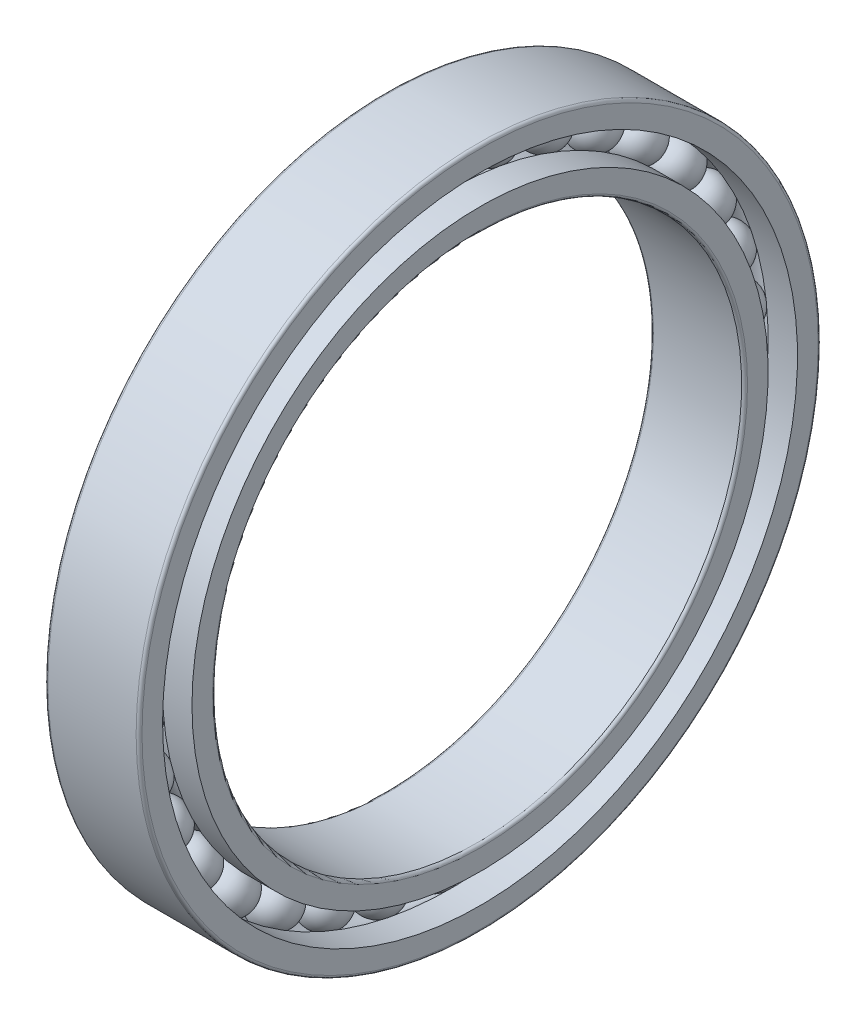
from build123d import *

# Parameters (mm, degrees)
CIRPATTERN1_COUNT = 34


with BuildPart() as part:
    # Sketch2 → Revolve1 (revolve)
    with BuildSketch(Plane.XY, mode=Mode.PRIVATE) as revolve1_sk:
        with BuildLine():
            Line((-3.75, 29), (3.75, 29))
            ThreePointArc((3.75, 29), (3.926776695, 28.926776695), (4, 28.75))
            Line((4, 28.75), (4, 27))
            Line((4, 27), (1.496662955, 27))
            ThreePointArc((1.496662955, 27), (0, 27.7), (-1.496662955, 27))
            Line((-1.496662955, 27), (-4, 27))
            Line((-4, 27), (-4, 28.75))
            ThreePointArc((-4, 28.75), (-3.926776695, 28.926776695), (-3.75, 29))
        make_face()
        with BuildLine():
            Line((4, 24.5), (4, 22.75))
            ThreePointArc((4, 22.75), (3.926776695, 22.573223305), (3.75, 22.5))
            Line((3.75, 22.5), (-3.75, 22.5))
            ThreePointArc((-3.75, 22.5), (-3.926776695, 22.573223305), (-4, 22.75))
            Line((-4, 22.75), (-4, 24.5))
            Line((-4, 24.5), (-1.496662955, 24.5))
            ThreePointArc((-1.496662955, 24.5), (0, 23.8), (1.496662955, 24.5))
            Line((1.496662955, 24.5), (4, 24.5))
        make_face()
    revolve(revolve1_sk.sketch.rotate(Axis((0, 0, 0), (1, 0, 0)), 90), axis=Axis((0, 0, 0), (1, 0, 0)))


with BuildPart() as body_2:
    # Sketch3 → Revolve2 (revolve)
    with BuildSketch(Plane.XY):
        with BuildLine():
            Line((-1.95, 25.75), (1.95, 25.75))
            ThreePointArc((1.95, 25.75), (0, 23.8), (-1.95, 25.75))
        make_face()
    revolve(axis=Axis((-1.95, 25.75, 0), (1, 0, 0)))


with BuildPart() as cirpattern1_1:
    # CirPattern1: pattern copy
    add(body_2.part.rotate(Axis((0, 0, 0), (1, 0, 0)), 1 * 360 / CIRPATTERN1_COUNT))


with BuildPart() as cirpattern1_2:
    # CirPattern1: pattern copy
    add(body_2.part.rotate(Axis((0, 0, 0), (1, 0, 0)), 2 * 360 / CIRPATTERN1_COUNT))


with BuildPart() as cirpattern1_3:
    # CirPattern1: pattern copy
    add(body_2.part.rotate(Axis((0, 0, 0), (1, 0, 0)), 3 * 360 / CIRPATTERN1_COUNT))


with BuildPart() as cirpattern1_4:
    # CirPattern1: pattern copy
    add(body_2.part.rotate(Axis((0, 0, 0), (1, 0, 0)), 4 * 360 / CIRPATTERN1_COUNT))


with BuildPart() as cirpattern1_5:
    # CirPattern1: pattern copy
    add(body_2.part.rotate(Axis((0, 0, 0), (1, 0, 0)), 5 * 360 / CIRPATTERN1_COUNT))


with BuildPart() as cirpattern1_6:
    # CirPattern1: pattern copy
    add(body_2.part.rotate(Axis((0, 0, 0), (1, 0, 0)), 6 * 360 / CIRPATTERN1_COUNT))


with BuildPart() as cirpattern1_7:
    # CirPattern1: pattern copy
    add(body_2.part.rotate(Axis((0, 0, 0), (1, 0, 0)), 7 * 360 / CIRPATTERN1_COUNT))


with BuildPart() as cirpattern1_8:
    # CirPattern1: pattern copy
    add(body_2.part.rotate(Axis((0, 0, 0), (1, 0, 0)), 8 * 360 / CIRPATTERN1_COUNT))


with BuildPart() as cirpattern1_9:
    # CirPattern1: pattern copy
    add(body_2.part.rotate(Axis((0, 0, 0), (1, 0, 0)), 9 * 360 / CIRPATTERN1_COUNT))


with BuildPart() as cirpattern1_10:
    # CirPattern1: pattern copy
    add(body_2.part.rotate(Axis((0, 0, 0), (1, 0, 0)), 10 * 360 / CIRPATTERN1_COUNT))


with BuildPart() as cirpattern1_11:
    # CirPattern1: pattern copy
    add(body_2.part.rotate(Axis((0, 0, 0), (1, 0, 0)), 11 * 360 / CIRPATTERN1_COUNT))


with BuildPart() as cirpattern1_12:
    # CirPattern1: pattern copy
    add(body_2.part.rotate(Axis((0, 0, 0), (1, 0, 0)), 12 * 360 / CIRPATTERN1_COUNT))


with BuildPart() as cirpattern1_13:
    # CirPattern1: pattern copy
    add(body_2.part.rotate(Axis((0, 0, 0), (1, 0, 0)), 13 * 360 / CIRPATTERN1_COUNT))


with BuildPart() as cirpattern1_14:
    # CirPattern1: pattern copy
    add(body_2.part.rotate(Axis((0, 0, 0), (1, 0, 0)), 14 * 360 / CIRPATTERN1_COUNT))


with BuildPart() as cirpattern1_15:
    # CirPattern1: pattern copy
    add(body_2.part.rotate(Axis((0, 0, 0), (1, 0, 0)), 15 * 360 / CIRPATTERN1_COUNT))


with BuildPart() as cirpattern1_16:
    # CirPattern1: pattern copy
    add(body_2.part.rotate(Axis((0, 0, 0), (1, 0, 0)), 16 * 360 / CIRPATTERN1_COUNT))


with BuildPart() as cirpattern1_17:
    # CirPattern1: pattern copy
    add(body_2.part.rotate(Axis((0, 0, 0), (1, 0, 0)), 17 * 360 / CIRPATTERN1_COUNT))


with BuildPart() as cirpattern1_18:
    # CirPattern1: pattern copy
    add(body_2.part.rotate(Axis((0, 0, 0), (1, 0, 0)), 18 * 360 / CIRPATTERN1_COUNT))


with BuildPart() as cirpattern1_19:
    # CirPattern1: pattern copy
    add(body_2.part.rotate(Axis((0, 0, 0), (1, 0, 0)), 19 * 360 / CIRPATTERN1_COUNT))


with BuildPart() as cirpattern1_20:
    # CirPattern1: pattern copy
    add(body_2.part.rotate(Axis((0, 0, 0), (1, 0, 0)), 20 * 360 / CIRPATTERN1_COUNT))


with BuildPart() as cirpattern1_21:
    # CirPattern1: pattern copy
    add(body_2.part.rotate(Axis((0, 0, 0), (1, 0, 0)), 21 * 360 / CIRPATTERN1_COUNT))


with BuildPart() as cirpattern1_22:
    # CirPattern1: pattern copy
    add(body_2.part.rotate(Axis((0, 0, 0), (1, 0, 0)), 22 * 360 / CIRPATTERN1_COUNT))


with BuildPart() as cirpattern1_23:
    # CirPattern1: pattern copy
    add(body_2.part.rotate(Axis((0, 0, 0), (1, 0, 0)), 23 * 360 / CIRPATTERN1_COUNT))


with BuildPart() as cirpattern1_24:
    # CirPattern1: pattern copy
    add(body_2.part.rotate(Axis((0, 0, 0), (1, 0, 0)), 24 * 360 / CIRPATTERN1_COUNT))


with BuildPart() as cirpattern1_25:
    # CirPattern1: pattern copy
    add(body_2.part.rotate(Axis((0, 0, 0), (1, 0, 0)), 25 * 360 / CIRPATTERN1_COUNT))


with BuildPart() as cirpattern1_26:
    # CirPattern1: pattern copy
    add(body_2.part.rotate(Axis((0, 0, 0), (1, 0, 0)), 26 * 360 / CIRPATTERN1_COUNT))


with BuildPart() as cirpattern1_27:
    # CirPattern1: pattern copy
    add(body_2.part.rotate(Axis((0, 0, 0), (1, 0, 0)), 27 * 360 / CIRPATTERN1_COUNT))


with BuildPart() as cirpattern1_28:
    # CirPattern1: pattern copy
    add(body_2.part.rotate(Axis((0, 0, 0), (1, 0, 0)), 28 * 360 / CIRPATTERN1_COUNT))


with BuildPart() as cirpattern1_29:
    # CirPattern1: pattern copy
    add(body_2.part.rotate(Axis((0, 0, 0), (1, 0, 0)), 29 * 360 / CIRPATTERN1_COUNT))


with BuildPart() as cirpattern1_30:
    # CirPattern1: pattern copy
    add(body_2.part.rotate(Axis((0, 0, 0), (1, 0, 0)), 30 * 360 / CIRPATTERN1_COUNT))


with BuildPart() as cirpattern1_31:
    # CirPattern1: pattern copy
    add(body_2.part.rotate(Axis((0, 0, 0), (1, 0, 0)), 31 * 360 / CIRPATTERN1_COUNT))


with BuildPart() as cirpattern1_32:
    # CirPattern1: pattern copy
    add(body_2.part.rotate(Axis((0, 0, 0), (1, 0, 0)), 32 * 360 / CIRPATTERN1_COUNT))


with BuildPart() as cirpattern1_33:
    # CirPattern1: pattern copy
    add(body_2.part.rotate(Axis((0, 0, 0), (1, 0, 0)), 33 * 360 / CIRPATTERN1_COUNT))


solid = Compound([part.part, body_2.part, cirpattern1_1.part, cirpattern1_2.part, cirpattern1_3.part, cirpattern1_4.part, cirpattern1_5.part, cirpattern1_6.part, cirpattern1_7.part, cirpattern1_8.part, cirpattern1_9.part, cirpattern1_10.part, cirpattern1_11.part, cirpattern1_12.part, cirpattern1_13.part, cirpattern1_14.part, cirpattern1_15.part, cirpattern1_16.part, cirpattern1_17.part, cirpattern1_18.part, cirpattern1_19.part, cirpattern1_20.part, cirpattern1_21.part, cirpattern1_22.part, cirpattern1_23.part, cirpattern1_24.part, cirpattern1_25.part, cirpattern1_26.part, cirpattern1_27.part, cirpattern1_28.part, cirpattern1_29.part, cirpattern1_30.part, cirpattern1_31.part, cirpattern1_32.part, cirpattern1_33.part])
